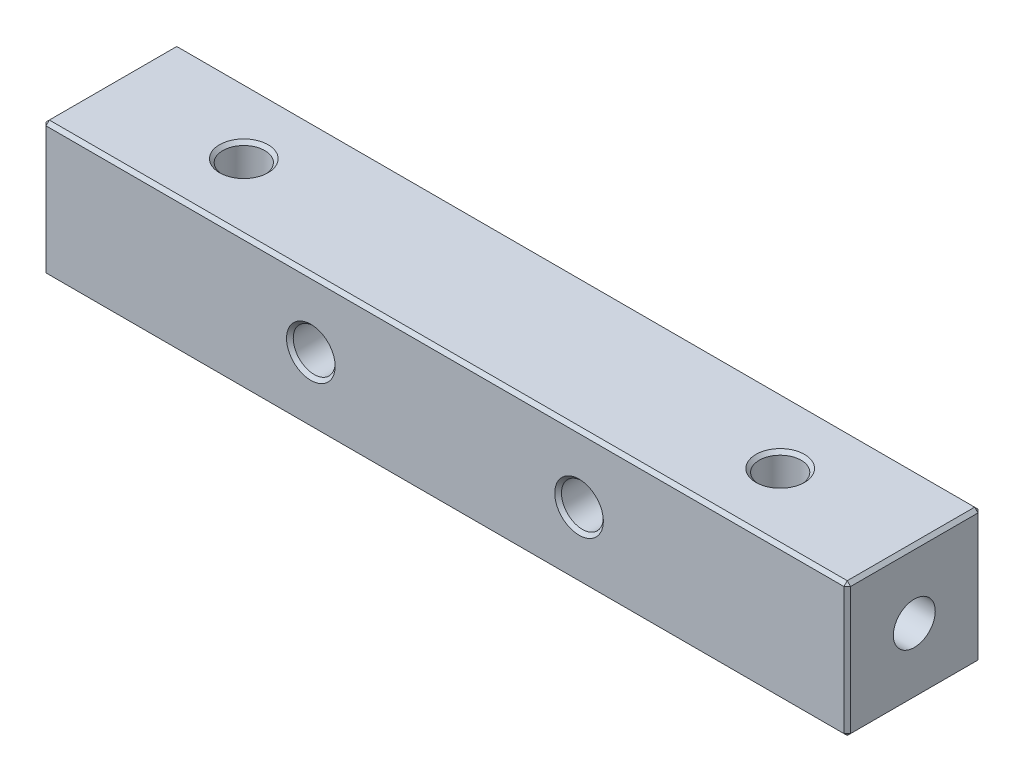
from build123d import *

# Parameters (mm, degrees)
SKETCH_1_W              = 48
SKETCH_1_H              = 8
EXTRUDE_1_DEPTH         = 4
HOLE_WIZARD_M3_1_D      = 2.5
HOLE_WIZARD_M3_2_D      = 2.5
CHAMFER_1_SIZE          = 0.2
HOLE_WIZARD_M3_3_REACH  = 50.332
HOLE_WIZARD_M3_3_BORE_R = 1.25
HOLE_WIZARD_M3_4_REACH  = 50.332
HOLE_WIZARD_M3_4_BORE_R = 1.25


with BuildPart() as part:
    # 草图1 → 凸台-拉伸1 (new, symmetric)
    with BuildSketch(Plane(origin=(0, 0, 0), x_dir=(1, 0, 0), z_dir=(0, 1, 0))):
        Rectangle(SKETCH_1_W, SKETCH_1_H)
    extrude(amount=EXTRUDE_1_DEPTH, both=True)

    # M3 螺纹孔1 (through all)
    with Locations(Plane(origin=(0, 4, 0), x_dir=(1, 0, 0), z_dir=(0, 1, 0))):
        with Locations((-16, 0), (16, 0)):
            Hole(HOLE_WIZARD_M3_1_D / 2)

    # M3 螺纹孔2 (through all)
    with Locations(Plane(origin=(0, 0, -4), x_dir=(-1, 0, 0), z_dir=(0, 0, -1))):
        with Locations((-8, 0), (8, 0)):
            Hole(HOLE_WIZARD_M3_2_D / 2)

    # 倒角1
    chamfer_1_edges = [part.edges().sort_by_distance(p)[0] for p in [
        (-24, 4, 0),
        (17.25, 4, 0),
        (17.25, -4, 0),
        (0, 4, 4),
        (-14.75, 4, 0),
        (-14.75, -4, 0),
        (-9.25, 0, -4),
        (-9.25, 0, 4),
        (6.75, 0, -4),
        (6.75, 0, 4),
        (24, 4, 0),
        (0, -4, 4),
        (-24, -4, 0),
        (0, -4, -4),
        (24, -4, 0),
        (24, 0, 4),
        (-24, 0, 4),
        (-24, 0, -4),
        (24, 0, -4),
        (0, 4, -4),
    ]]
    chamfer(chamfer_1_edges, length=CHAMFER_1_SIZE)

    # M3 螺纹孔3 bore → M3 螺纹孔3 (cut, up to next)
    with BuildSketch(Plane.ZY.offset(24), mode=Mode.PRIVATE) as hole_wizard_m3_3_sk1:
        Circle(HOLE_WIZARD_M3_3_BORE_R)
    hole_wizard_m3_3_tool1 = extrude(hole_wizard_m3_3_sk1.sketch, amount=-HOLE_WIZARD_M3_3_REACH, mode=Mode.PRIVATE) & part.part
    add(hole_wizard_m3_3_tool1.solids().sort_by_distance((-24, 0, 0))[0], mode=Mode.SUBTRACT)

    # M3 螺纹孔4 bore → M3 螺纹孔4 (cut, up to next)
    with BuildSketch(Plane(origin=(24, 0, 0), x_dir=(0, 0, -1), z_dir=(1, 0, 0)), mode=Mode.PRIVATE) as hole_wizard_m3_4_sk1:
        Circle(HOLE_WIZARD_M3_4_BORE_R)
    hole_wizard_m3_4_tool1 = extrude(hole_wizard_m3_4_sk1.sketch, amount=-HOLE_WIZARD_M3_4_REACH, mode=Mode.PRIVATE) & part.part
    add(hole_wizard_m3_4_tool1.solids().sort_by_distance((24, 0, 0))[0], mode=Mode.SUBTRACT)


solid = part.part
